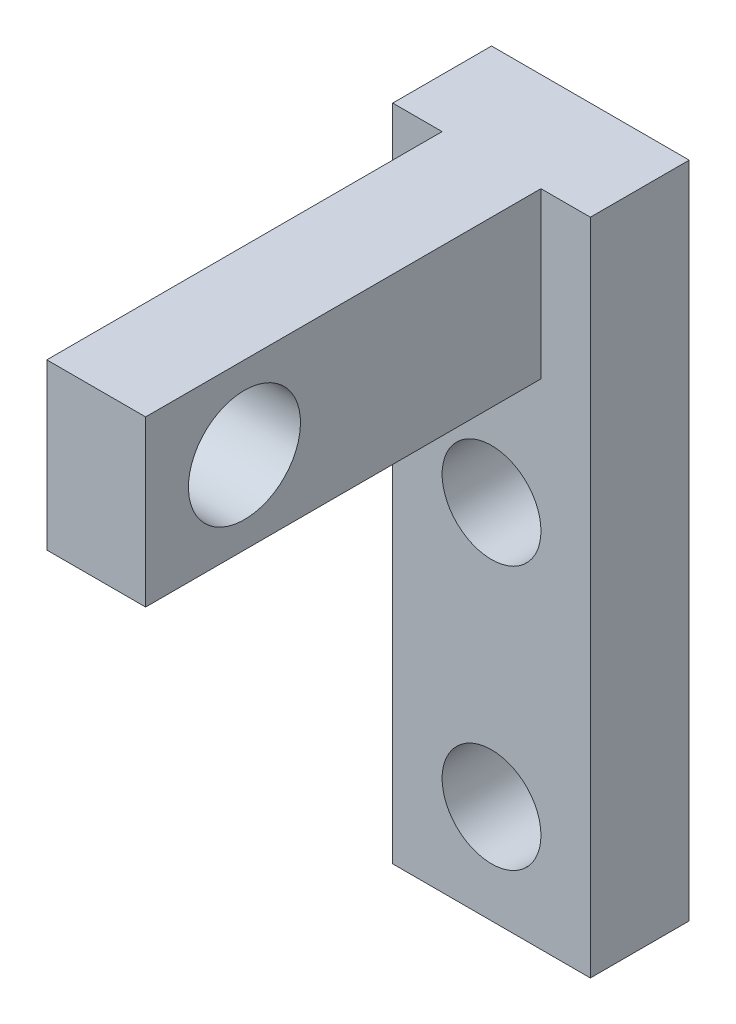
from build123d import *

# Parameters (mm, degrees)
SKETCH4_W           = 6
SKETCH4_H           = 20
SKETCH4_R           = 1.5
BOSS_EXTRUDE1_DEPTH = 3
SKETCH6_W           = 3
SKETCH6_H           = 5
BOSS_EXTRUDE2_DEPTH = 12
SKETCH7_R           = 1.7
CUT_EXTRUDE1_DEPTH  = 20.137659209


with BuildPart() as part:
    # Sketch4 → Boss-Extrude1 (new body)
    with BuildSketch(Plane.XY):
        with Locations((0, -1)):
            Rectangle(SKETCH4_W, SKETCH4_H)
        Circle(SKETCH4_R, mode=Mode.SUBTRACT)
        with Locations((0, -8)):
            Circle(SKETCH4_R, mode=Mode.SUBTRACT)
    extrude(amount=BOSS_EXTRUDE1_DEPTH)

    # Sketch6 → Boss-Extrude2 (add)
    with BuildSketch(Plane.XY.offset(3)):
        with Locations((0, 6.5)):
            Rectangle(SKETCH6_W, SKETCH6_H)
    extrude(amount=BOSS_EXTRUDE2_DEPTH)

    # Sketch7 → Cut-Extrude1 (cut, through all)
    with BuildSketch(Plane(origin=(1.5, 0, 0), x_dir=(0, 0, -1), z_dir=(1, 0, 0))):
        with Locations(Location((-12, 6.5, 0), (0, 0, 90))):
            Circle(SKETCH7_R)
    extrude(amount=-CUT_EXTRUDE1_DEPTH, mode=Mode.SUBTRACT)


solid = part.part
